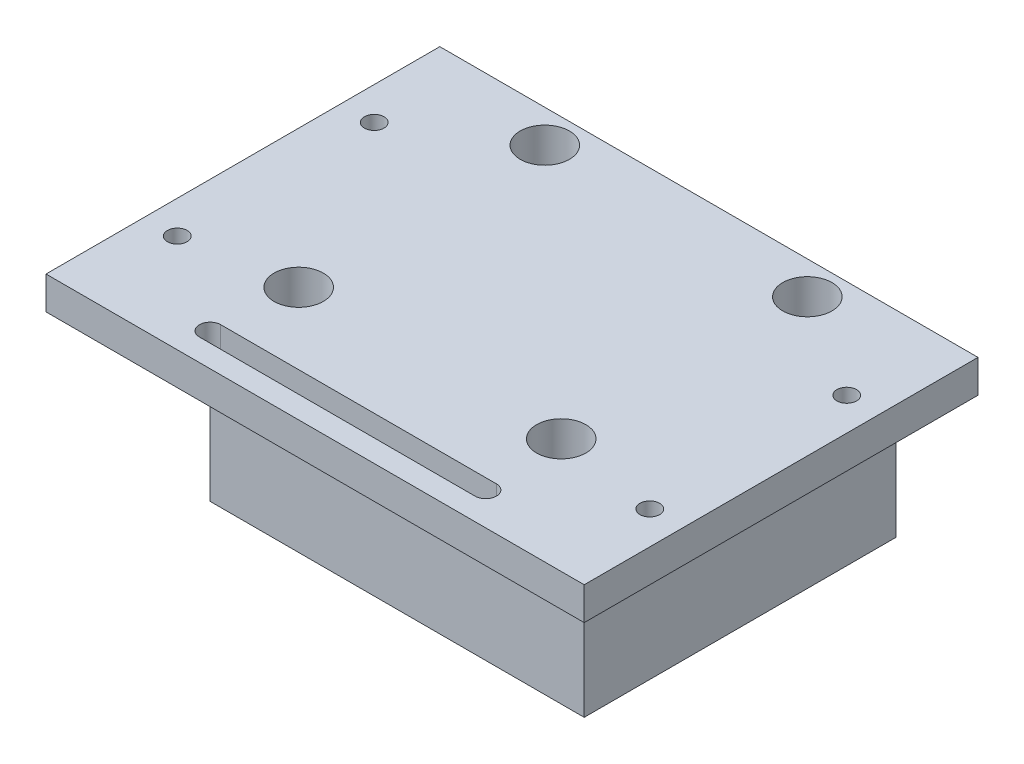
from build123d import *

# Parameters (mm, degrees)
SKETCH_1_W               = 114
SKETCH_1_H               = 95
EXTRUDE_1_DEPTH          = 60
SKETCH_7_W               = 114
SKETCH_7_H               = 25
EXTRUDE_3_DEPTH          = 10
SKETCH_14_R              = 7.5
CUT_EXTRUDE_9_DEPTH      = 50
SKETCH_15_R              = 3.3
CUT_EXTRUDE_10_DEPTH     = 50
MIRROR_2_COPY_1_SKETCH_R = 7.5
MIRROR_2_COPY_1_DEPTH    = 50
MIRROR_2_COPY_2_SKETCH_R = 3.3
MIRROR_2_COPY_2_DEPTH    = 50
CUT_EXTRUDE_8_DEPTH      = 10
SKETCH_16_R              = 3
CUT_EXTRUDE_11_DEPTH     = 50


with BuildPart() as part:
    # 草图1 → 凸台-拉伸1 (new body)
    with BuildSketch(Plane(origin=(0, 0, 0), x_dir=(1, 0, 0), z_dir=(0, 1, 0))):
        Rectangle(SKETCH_1_W, SKETCH_1_H)
    extrude(amount=EXTRUDE_1_DEPTH)

    # 草图7 → 凸台-拉伸3 (add)
    with BuildSketch(Plane(origin=(0, 60, 0), x_dir=(1, 0, 0), z_dir=(0, 1, 0))):
        with Locations((0, -60)):
            Rectangle(SKETCH_7_W, SKETCH_7_H)
        Polygon((-82, -72.5), (-82, 47.5), (-57, 47.5), (-57, -47.5), (-57, -72.5), align=None)
        Polygon((57, -72.5), (82, -72.5), (82, 47.5), (57, 47.5), (57, -47.5), align=None)
    extrude(amount=-EXTRUDE_3_DEPTH)

    # 草图14 → 切除-拉伸9 (cut)
    with BuildSketch(Plane(origin=(0, 60, 0), x_dir=(1, 0, 0), z_dir=(0, 1, 0))):
        with Locations(Location((-40, -37.5, 0), (0, 0, 270))):
            Circle(SKETCH_14_R)
    cut_extrude_9 = extrude(amount=-CUT_EXTRUDE_9_DEPTH, mode=Mode.SUBTRACT)

    # 草图15 → 切除-拉伸10 (cut)
    with BuildSketch(Plane(origin=(0, 10, 0), x_dir=(1, 0, 0), z_dir=(0, 1, 0))):
        with Locations(Location((-40, -37.5, 0), (0, 0, 270))):
            Circle(SKETCH_15_R)
    cut_extrude_10 = extrude(amount=-CUT_EXTRUDE_10_DEPTH, mode=Mode.SUBTRACT)

    # 镜向1: 切除-拉伸9, 切除-拉伸10 across plane
    add(cut_extrude_9.mirror(Plane(origin=(0, 0, 0), x_dir=(0, 0, 1), z_dir=(1, 0, 0))), mode=Mode.SUBTRACT)
    add(cut_extrude_10.mirror(Plane(origin=(0, 0, 0), x_dir=(0, 0, 1), z_dir=(1, 0, 0))), mode=Mode.SUBTRACT)

    # 镜向2: 切除-拉伸9, 切除-拉伸10 across plane
    add(cut_extrude_9.mirror(Plane.XY), mode=Mode.SUBTRACT)
    add(cut_extrude_10.mirror(Plane.XY), mode=Mode.SUBTRACT)

    # 镜向2 copy 1 sketch → 镜向2 copy 1 (cut)
    with BuildSketch(Plane(origin=(0, 60, 0), x_dir=(-1, 0, 0), z_dir=(0, 1, 0))):
        with Locations(Location((-40, -37.5, 0), (0, 0, 270))):
            Circle(MIRROR_2_COPY_1_SKETCH_R)
    extrude(amount=-MIRROR_2_COPY_1_DEPTH, mode=Mode.SUBTRACT)

    # 镜向2 copy 2 sketch → 镜向2 copy 2 (cut)
    with BuildSketch(Plane(origin=(0, 10, 0), x_dir=(-1, 0, 0), z_dir=(0, 1, 0))):
        with Locations(Location((-40, -37.5, 0), (0, 0, 270))):
            Circle(MIRROR_2_COPY_2_SKETCH_R)
    extrude(amount=-MIRROR_2_COPY_2_DEPTH, mode=Mode.SUBTRACT)

    # 草图13 → 切除-拉伸8 (cut)
    with BuildSketch(Plane.XZ.offset(-50)):
        with BuildLine():
            Line((-42, 59.25), (42, 59.25))
            ThreePointArc((42, 59.25), (45.25, 62.5), (42, 65.75))
            Line((42, 65.75), (-42, 65.75))
            ThreePointArc((-42, 65.75), (-45.25, 62.5), (-42, 59.25))
        make_face()
    extrude(amount=-CUT_EXTRUDE_8_DEPTH, mode=Mode.SUBTRACT)

    # 草图16 → 切除-拉伸11 (cut)
    with BuildSketch(Plane.XZ.offset(-50)):
        with Locations(Location((-72, -17.5, 0), (0, 0, 270))):
            Circle(SKETCH_16_R)
        with Locations(Location((-72, 42.5, 0), (0, 0, 270))):
            Circle(SKETCH_16_R)
    cut_extrude_11 = extrude(amount=-CUT_EXTRUDE_11_DEPTH, mode=Mode.SUBTRACT)

    # 镜向3: 切除-拉伸11 across plane
    add(cut_extrude_11.mirror(Plane(origin=(0, 0, 0), x_dir=(0, 0, 1), z_dir=(1, 0, 0))), mode=Mode.SUBTRACT)


solid = part.part
